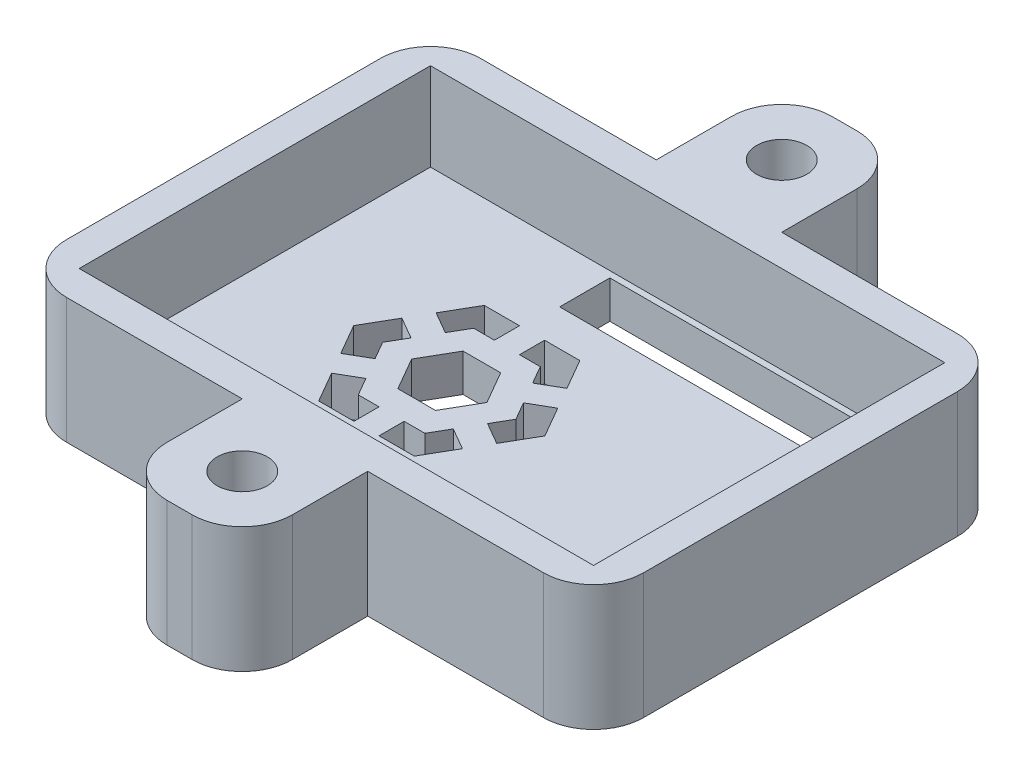
from build123d import *

# Parameters (mm, degrees)
BASE_W               = 46
BASE_H               = 33
SHELL_DEPTH          = 10
SHELLHOLE_W          = 41
SHELLHOLE_H          = 28
HOLE_DEPTH           = 7
PINHOLES_W           = 23
PINHOLES_H           = 4
PINS_DEPTH           = 3
SKETCH10_W           = 10
SKETCH10_H           = 10
BOSS_EXTRUDE3_DEPTH  = 10
SKETCH11_R           = 2
CUT_EXTRUDE3_DEPTH   = 10
FILLET1_R            = 4
FILLET1_OF_MIRROR1_R = 4
FILLET2_R            = 4
AIR1_DEPTH           = 10


with BuildPart() as part:
    # Base → Shell (new body)
    with BuildSketch(Plane(origin=(0, 0, 0), x_dir=(1, 0, 0), z_dir=(0, 1, 0))):
        Rectangle(BASE_W, BASE_H)
    extrude(amount=SHELL_DEPTH)

    # ShellHole → Hole (cut)
    with BuildSketch(Plane(origin=(0, 10, 0), x_dir=(1, 0, 0), z_dir=(0, 1, 0))):
        Rectangle(SHELLHOLE_W, SHELLHOLE_H)
    extrude(amount=-HOLE_DEPTH, mode=Mode.SUBTRACT)

    # PinHoles → Pins (cut)
    with BuildSketch(Plane(origin=(0, 0, 0), x_dir=(-1, 0, 0), z_dir=(0, -1, 0))):
        with Locations((-5.8, -11.5)):
            Rectangle(PINHOLES_W, PINHOLES_H)
        with Locations((-5.8, 11.5)):
            Rectangle(PINHOLES_W, PINHOLES_H)
    extrude(amount=-PINS_DEPTH, mode=Mode.SUBTRACT)

    # Sketch10 → Boss-Extrude3 (add)
    with BuildSketch(Plane.XY.offset(16.5)):
        with Locations((0, 5)):
            Rectangle(SKETCH10_W, SKETCH10_H)
    boss_extrude3 = extrude(amount=BOSS_EXTRUDE3_DEPTH)

    # Sketch11 → Cut-Extrude3 (cut)
    with BuildSketch(Plane(origin=(0, 10, 0), x_dir=(1, 0, 0), z_dir=(0, 1, 0))):
        with Locations(Location((0, -21.5, 0), (0, 0, 270))):
            Circle(SKETCH11_R)
    cut_extrude3 = extrude(amount=-CUT_EXTRUDE3_DEPTH, mode=Mode.SUBTRACT)

    # Fillet1
    fillet1_edges = [part.edges().sort_by_distance(p)[0] for p in [
        (5, 5, 26.5),
        (-5, 5, 26.5),
    ]]
    fillet(fillet1_edges, radius=FILLET1_R)

    # Mirror1: Boss-Extrude3, Cut-Extrude3 across plane
    add(boss_extrude3.mirror(Plane.XY))
    add(cut_extrude3.mirror(Plane.XY), mode=Mode.SUBTRACT)

    # Fillet1 of Mirror1
    fillet1_of_mirror1_edges = [part.edges().sort_by_distance(p)[0] for p in [
        (5, 5, -26.5),
        (-5, 5, -26.5),
    ]]
    fillet(fillet1_of_mirror1_edges, radius=FILLET1_OF_MIRROR1_R)

    # Fillet2
    fillet2_edges = [part.edges().sort_by_distance(p)[0] for p in [
        (-23, 5, -16.5),
        (23, 5, -16.5),
        (23, 5, 16.5),
        (-23, 5, 16.5),
    ]]
    fillet(fillet2_edges, radius=FILLET2_R)

    # AirHole → Air1 (cut)
    with BuildSketch(Plane(origin=(0, 3, 0), x_dir=(1, 0, 0), z_dir=(0, 1, 0))):
        Polygon((-3.5, 2.598076211), (-6.5, 2.598076211), (-8, 0), (-6.5, -2.598076211), (-3.5, -2.598076211), (-2, 0), align=None)
        Polygon((-10.214101615, 4.165063509), (-8.482050808, 3.165063509), (-7.654700538, 4.598076211), (-6, 4.598076211), (-6, 6.598076211), (-8.809401077, 6.598076211), align=None)
        Polygon((-11.214101615, -2.433012702), (-9.482050808, -1.433012702), (-10.309401077, 0), (-9.482050808, 1.433012702), (-11.214101615, 2.433012702), (-12.618802154, 0), align=None)
        Polygon((-7.654700538, -4.598076211), (-8.482050808, -3.165063509), (-10.214101615, -4.165063509), (-8.809401077, -6.598076211), (-6, -6.598076211), (-6, -4.598076211), align=None)
        Polygon((-2.345299462, -4.598076211), (-4, -4.598076211), (-4, -6.598076211), (-1.190598923, -6.598076211), (0.214101615, -4.165063509), (-1.517949192, -3.165063509), align=None)
        Polygon((0.309401077, 0), (-0.517949192, -1.433012702), (1.214101615, -2.433012702), (2.618802154, 0), (1.214101615, 2.433012702), (-0.517949192, 1.433012702), align=None)
        Polygon((-4, 6.598076211), (-4, 4.598076211), (-2.345299462, 4.598076211), (-1.517949192, 3.165063509), (0.214101615, 4.165063509), (-1.190598923, 6.598076211), align=None)
    extrude(amount=-AIR1_DEPTH, mode=Mode.SUBTRACT)


solid = part.part
